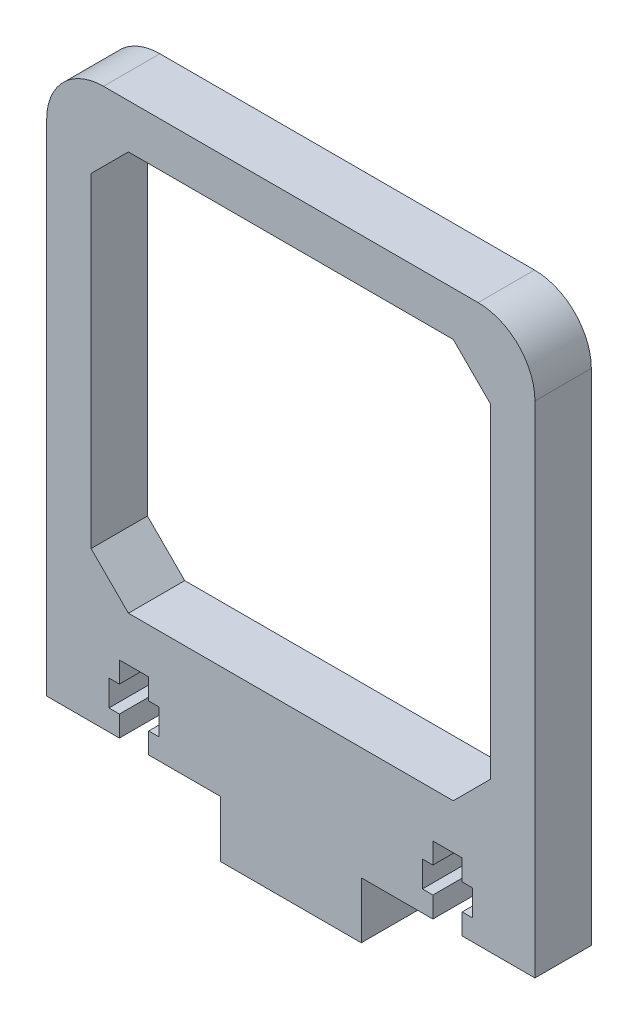
from build123d import *

# Parameters (mm, degrees)
SKETCH2_W           = 110
SKETCH2_H           = 125.38
BOSS_EXTRUDE1_DEPTH = 12.7
FILLET1_R           = 12.8
CUT_EXTRUDE1_DEPTH  = 12.7
BOSS_EXTRUDE2_DEPTH = 12.7


with BuildPart() as part:
    # Sketch2 → Boss-Extrude1 (new body)
    with BuildSketch(Plane.XY):
        with Locations((0, -7.69)):
            Rectangle(SKETCH2_W, SKETCH2_H)
        Polygon((-45, -36.592348927), (-45, 36.592348927), (-36.592348927, 45), (36.592348927, 45), (45, 36.592348927), (45, -36.592348927), (36.592348927, -45), (-36.592348927, -45), align=None, mode=Mode.SUBTRACT)
    extrude(amount=BOSS_EXTRUDE1_DEPTH)

    # Fillet1
    fillet1_edges = [part.edges().sort_by_distance(p)[0] for p in [
        (55, 55, 6.35),
        (-55, 55, 6.35),
    ]]
    fillet(fillet1_edges, radius=FILLET1_R)

    # Sketch5 → Cut-Extrude1 (cut)
    with BuildSketch(Plane(origin=(0, 0, 0), x_dir=(-1, 0, 0), z_dir=(0, 0, -1))):
        Polygon((-38.610878355, -70.38), (-38.610878355, -65.681), (-40.972878355, -65.681), (-40.972878355, -59.839), (-38.610878355, -59.839), (-38.610878355, -55.14), (-32.006878355, -55.14), (-32.006878355, -59.839), (-29.644878355, -59.839), (-29.644878355, -65.681), (-32.006878355, -65.681), (-32.006878355, -70.38), align=None)
        Polygon((32.006878355, -65.681), (32.006878355, -70.38), (38.610878355, -70.38), (38.610878355, -65.681), (40.972878355, -65.681), (40.972878355, -59.839), (38.610878355, -59.839), (38.610878355, -55.14), (32.006878355, -55.14), (32.006878355, -59.839), (29.644878355, -59.839), (29.644878355, -65.681), align=None)
    extrude(amount=-CUT_EXTRUDE1_DEPTH, mode=Mode.SUBTRACT)

    # Sketch6 → Boss-Extrude2 (add)
    with BuildSketch(Plane.XZ.offset(70.38)):
        Polygon((0, 0), (15.875, 0), (15.875, 12.7), (-15.875, 12.7), (-15.875, 0), align=None)
    extrude(amount=BOSS_EXTRUDE2_DEPTH)


solid = part.part
